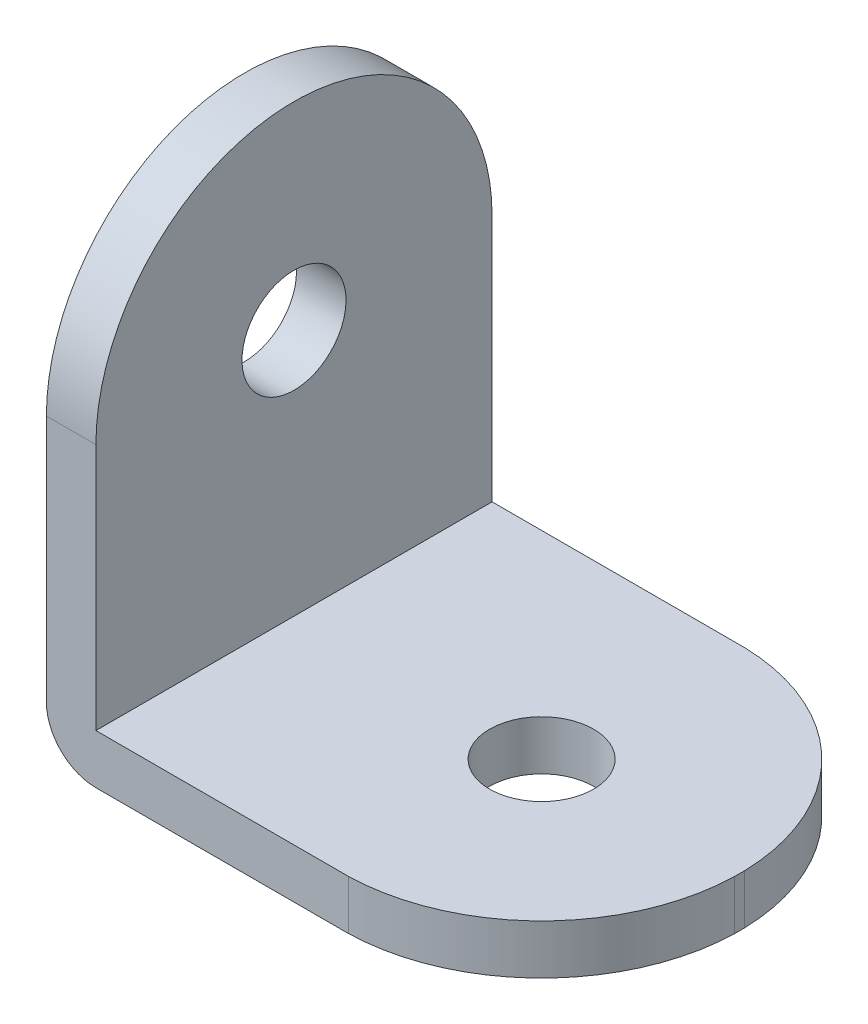
from build123d import *

# Parameters (mm, degrees)
SKETCH_1_W          = 20
SKETCH_1_H          = 20
EXTRUDE_1_DEPTH     = 16
SKETCH_2_W          = 18
SKETCH_2_H          = 18
CUT_EXTRUDE_1_DEPTH = 16
SKETCH_3_R          = 2.1
CUT_EXTRUDE_2_DEPTH = 16
SKETCH_4_R          = 2.1
CUT_EXTRUDE_3_DEPTH = 16
CUT_EXTRUDE_4_DEPTH = 16
CUT_EXTRUDE_5_DEPTH = 16
CUT_EXTRUDE_6_DEPTH = 16


with BuildPart() as part:
    # 草图1 → 凸台-拉伸1 (new body)
    with BuildSketch(Plane.XY):
        Rectangle(SKETCH_1_W, SKETCH_1_H)
    extrude(amount=EXTRUDE_1_DEPTH)

    # 草图2 → 切除-拉伸1 (cut)
    with BuildSketch(Plane.XY.offset(16)):
        with Locations((1, 1)):
            Rectangle(SKETCH_2_W, SKETCH_2_H)
    extrude(amount=-CUT_EXTRUDE_1_DEPTH, mode=Mode.SUBTRACT)

    # 草图3 → 切除-拉伸2 (cut)
    with BuildSketch(Plane(origin=(-8, 0, 0), x_dir=(0, 0, -1), z_dir=(1, 0, 0))):
        with Locations(Location((-8, 2, 0), (0, 0, 90))):
            Circle(SKETCH_3_R)
    extrude(amount=-CUT_EXTRUDE_2_DEPTH, mode=Mode.SUBTRACT)

    # 草图4 → 切除-拉伸3 (cut)
    with BuildSketch(Plane(origin=(0, -8, 0), x_dir=(1, 0, 0), z_dir=(0, 1, 0))):
        with Locations(Location((2, -8, 0), (0, 0, 180))):
            Circle(SKETCH_4_R)
    extrude(amount=-CUT_EXTRUDE_3_DEPTH, mode=Mode.SUBTRACT)

    # 草图5 → 切除-拉伸4 (cut)
    with BuildSketch(Plane(origin=(-8, 0, 0), x_dir=(0, 0, -1), z_dir=(1, 0, 0))):
        with BuildLine():
            Line((-16, 10), (-16, 2))
            ThreePointArc((-16, 2), (-13.656854261, 7.656854238), (-8.000000031, 10))
            Line((-8.000000031, 10), (-16, 10))
        make_face()
        with BuildLine():
            Line((0, 10), (-8.000000031, 10))
            ThreePointArc((-8.000000031, 10), (-2.343145762, 7.656854261), (0, 2))
            Line((0, 2), (0, 10))
        make_face()
    extrude(amount=-CUT_EXTRUDE_4_DEPTH, mode=Mode.SUBTRACT)

    # 草图6 → 切除-拉伸5 (cut)
    with BuildSketch(Plane(origin=(0, -8, 0), x_dir=(1, 0, 0), z_dir=(0, 1, 0))):
        with BuildLine():
            Line((10, -7.79882112), (10, 0))
            Line((10, 0), (2.20117888, 0))
            ThreePointArc((2.20117888, 0), (7.658642635, -2.341357365), (10, -7.79882112))
        make_face()
        with BuildLine():
            Line((10, -16), (10, -8.20117888))
            ThreePointArc((10, -8.20117888), (7.658642635, -13.658642635), (2.20117888, -16))
            Line((2.20117888, -16), (10, -16))
        make_face()
    extrude(amount=-CUT_EXTRUDE_5_DEPTH, mode=Mode.SUBTRACT)

    # 草图7 → 切除-拉伸6 (cut)
    with BuildSketch(Plane.XY.offset(16)):
        with BuildLine():
            Line((-10, -8), (-10, -10))
            Line((-10, -10), (-8, -10))
            ThreePointArc((-8, -10), (-9.414213562, -9.414213562), (-10, -8))
        make_face()
    extrude(amount=-CUT_EXTRUDE_6_DEPTH, mode=Mode.SUBTRACT)


solid = part.part
